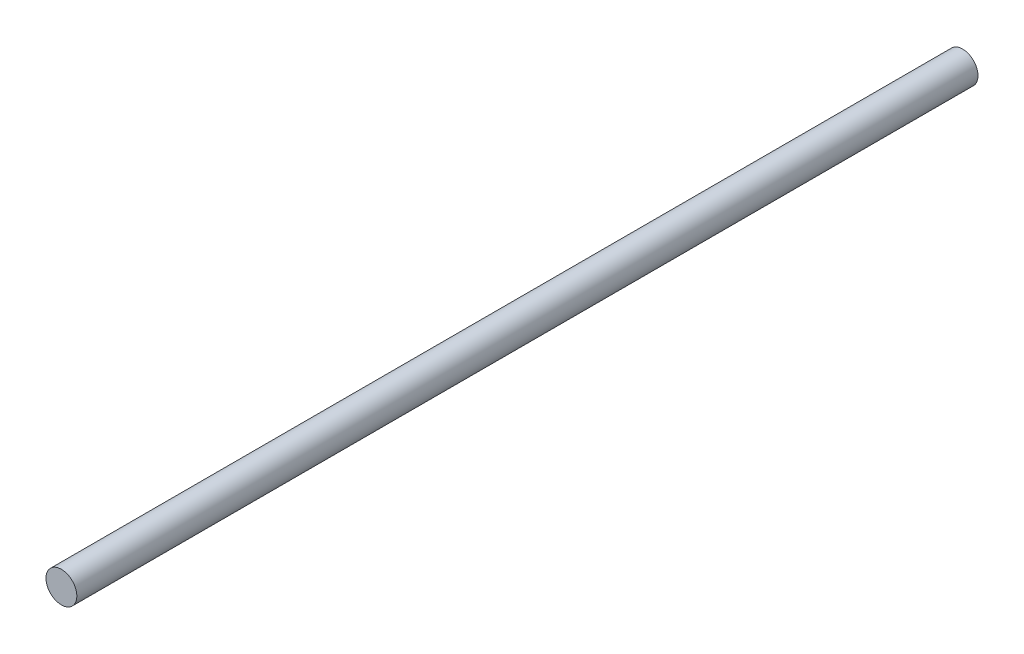
from build123d import *

# Parameters (mm, degrees)
SKETCH1_R           = 5
BOSS_EXTRUDE1_DEPTH = 292


with BuildPart() as part:
    # Sketch1 → Boss-Extrude1 (new body)
    with BuildSketch(Plane.XY):
        Circle(SKETCH1_R)
    extrude(amount=BOSS_EXTRUDE1_DEPTH)


solid = part.part
